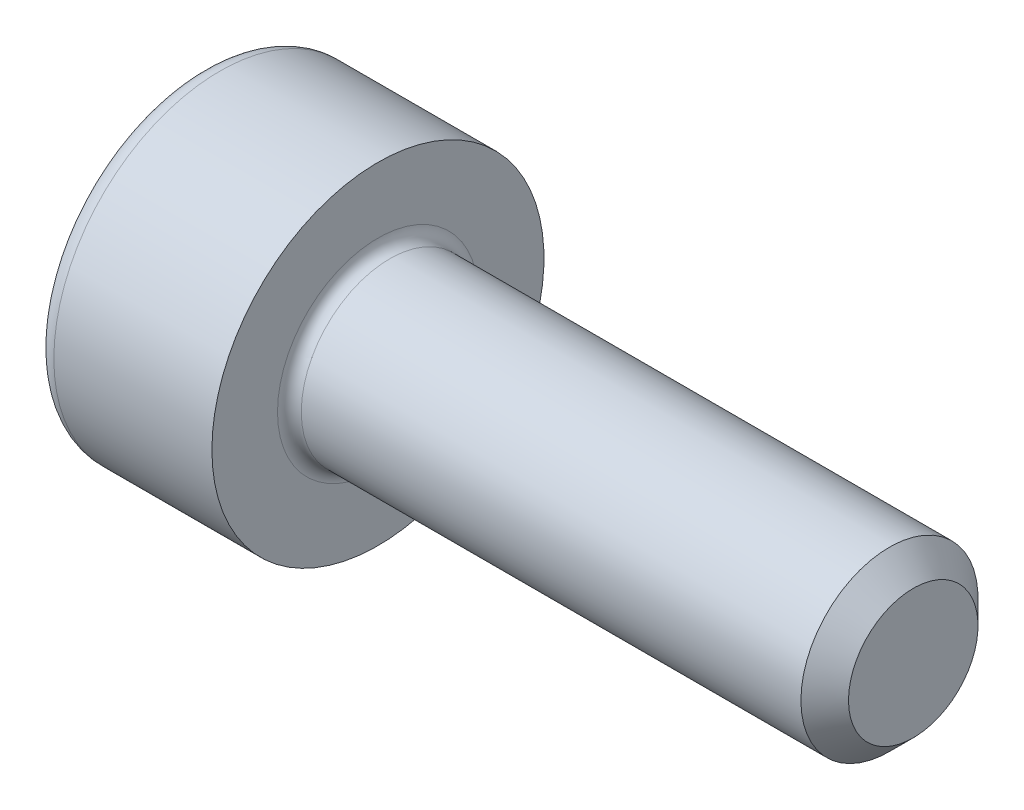
from build123d import *

# Parameters (mm, degrees)
FILLET1_R      = 0.1
FILLET2_R      = 0.16
CHAMFER1_SIZE  = 0.2
EXTRUDE1_DEPTH = 0.7


with BuildPart() as part:
    # Sketch1 → Revolve1 (revolve)
    with BuildSketch(Plane.XY, mode=Mode.PRIVATE) as revolve1_sk:
        Polygon((0, 1.395688245), (0, 0), (5.988734128, 0), (5.988734128, 0.744367064), (1.488734128, 0.744367064), (1.488734128, 1.395688245), align=None)
    revolve(revolve1_sk.sketch.rotate(Axis((0, 0, 0), (1, 0, 0)), 90), axis=Axis((0, 0, 0), (1, 0, 0)))

    # Fillet1
    fillet1_edges = [part.edges().sort_by_distance(p)[0] for p in [
        (1.488734128, 0, -0.744367064),
    ]]
    fillet(fillet1_edges, radius=FILLET1_R)

    # Fillet2
    fillet2_edges = [part.edges().sort_by_distance(p)[0] for p in [
        (0, 0, -1.395688245),
    ]]
    fillet(fillet2_edges, radius=FILLET2_R)

    # Chamfer1
    chamfer1_edges = [part.edges().sort_by_distance(p)[0] for p in [
        (5.988734128, 0, -0.744367064),
    ]]
    chamfer(chamfer1_edges, length=CHAMFER1_SIZE)

    # Sketch2 → Extrude1 (cut)
    with BuildSketch(Plane.ZY):
        Polygon((0, 0.877572409), (-0.76, 0.438786205), (-0.76, -0.438786205), (0, -0.877572409), (0.76, -0.438786205), (0.76, 0.438786205), align=None)
    extrude(amount=-EXTRUDE1_DEPTH, mode=Mode.SUBTRACT)


solid = part.part
